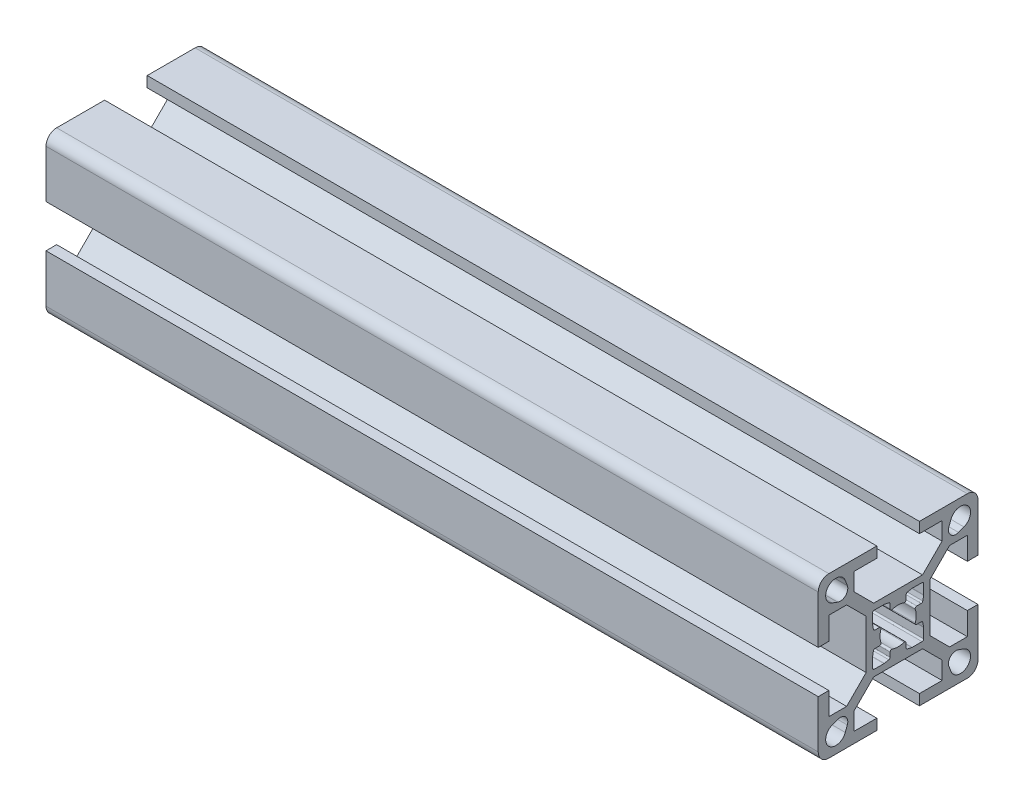
from build123d import *

# Parameters (mm, degrees)
BOSS_EXTRUDE1_DEPTH = 145


with BuildPart() as part:
    # Sketch1 → Boss-Extrude1 (new body)
    with BuildSketch(Plane(origin=(0, 0, 0), x_dir=(0, 0, -1), z_dir=(1, 0, 0))):
        with BuildLine():
            Line((-15, 13), (-15, 4))
            Line((-15, 4), (-13, 4))
            Line((-13, 4), (-13, 8.25))
            Line((-13, 8.25), (-9.664213562, 8.25))
            Line((-9.664213562, 8.25), (-6, 4.585786438))
            Line((-6, 4.585786438), (-6, -4.585786438))
            Line((-6, -4.585786438), (-9.664213562, -8.25))
            Line((-9.664213562, -8.25), (-13, -8.25))
            Line((-13, -8.25), (-13, -4))
            Line((-13, -4), (-15, -4))
            Line((-15, -4), (-15, -13))
            ThreePointArc((-15, -13), (-14.414213562, -14.414213562), (-13, -15))
            Line((-13, -15), (-4, -15))
            Line((-4, -15), (-4, -13))
            Line((-4, -13), (-8.25, -13))
            Line((-8.25, -13), (-8.25, -9.664213562))
            Line((-8.25, -9.664213562), (-4.585786438, -6))
            Line((-4.585786438, -6), (4.585786438, -6))
            Line((4.585786438, -6), (8.25, -9.664213562))
            Line((8.25, -9.664213562), (8.25, -13))
            Line((8.25, -13), (4, -13))
            Line((4, -13), (4, -15))
            Line((4, -15), (13, -15))
            ThreePointArc((13, -15), (14.414213562, -14.414213562), (15, -13))
            Line((15, -13), (15, -4))
            Line((15, -4), (13, -4))
            Line((13, -4), (13, -8.25))
            Line((13, -8.25), (9.664213562, -8.25))
            Line((9.664213562, -8.25), (6, -4.585786438))
            Line((6, -4.585786438), (6, 4.585786438))
            Line((6, 4.585786438), (9.664213562, 8.25))
            Line((9.664213562, 8.25), (13, 8.25))
            Line((13, 8.25), (13, 4))
            Line((13, 4), (15, 4))
            Line((15, 4), (15, 13))
            ThreePointArc((15, 13), (14.414213562, 14.414213562), (13, 15))
            Line((13, 15), (4, 15))
            Line((4, 15), (4, 13))
            Line((4, 13), (8.25, 13))
            Line((8.25, 13), (8.25, 9.664213562))
            Line((8.25, 9.664213562), (4.585786438, 6))
            Line((4.585786438, 6), (-4.585786438, 6))
            Line((-4.585786438, 6), (-8.25, 9.664213562))
            Line((-8.25, 9.664213562), (-8.25, 13))
            Line((-8.25, 13), (-4, 13))
            Line((-4, 13), (-4, 15))
            Line((-4, 15), (-13, 15))
            ThreePointArc((-13, 15), (-14.414213562, 14.414213562), (-15, 13))
        make_face()
        with BuildLine():
            Line((-9.539070071, 11.338915743), (-9.918883282, 12.361530981))
            ThreePointArc((-9.918883282, 12.361530981), (-13.043502884, 13.043502884), (-12.361530981, 9.918883282))
            Line((-12.361530981, 9.918883282), (-11.338915743, 9.539070071))
            ThreePointArc((-11.338915743, 9.539070071), (-9.861522369, 9.861522369), (-9.539070071, 11.338915743))
        make_face(mode=Mode.SUBTRACT)
        with BuildLine():
            Line((9.918883282, 12.361530981), (9.539070071, 11.338915743))
            ThreePointArc((9.539070071, 11.338915743), (9.861522369, 9.861522369), (11.338915743, 9.539070071))
            Line((11.338915743, 9.539070071), (12.361530981, 9.918883282))
            ThreePointArc((12.361530981, 9.918883282), (13.043502884, 13.043502884), (9.918883282, 12.361530981))
        make_face(mode=Mode.SUBTRACT)
        with BuildLine():
            Line((12.361530981, -9.918883282), (11.338915743, -9.539070071))
            ThreePointArc((11.338915743, -9.539070071), (9.861522369, -9.861522369), (9.539070071, -11.338915743))
            Line((9.539070071, -11.338915743), (9.918883282, -12.361530981))
            ThreePointArc((9.918883282, -12.361530981), (13.043502884, -13.043502884), (12.361530981, -9.918883282))
        make_face(mode=Mode.SUBTRACT)
        with BuildLine():
            Line((-11.338915743, -9.539070071), (-12.361530981, -9.918883282))
            ThreePointArc((-12.361530981, -9.918883282), (-13.043502884, -13.043502884), (-9.918883282, -12.361530981))
            Line((-9.918883282, -12.361530981), (-9.539070071, -11.338915743))
            ThreePointArc((-9.539070071, -11.338915743), (-9.861522369, -9.861522369), (-11.338915743, -9.539070071))
        make_face(mode=Mode.SUBTRACT)
        with BuildLine():
            Line((-4.8, -2.644433572), (-4.8, -4.5))
            ThreePointArc((-4.8, -4.5), (-4.712132034, -4.712132034), (-4.5, -4.8))
            Line((-4.5, -4.8), (-2.644433572, -4.8))
            ThreePointArc((-2.644433572, -4.8), (-2.615679847, -4.79861886), (-2.587190874, -4.794488155))
            Line((-2.587190874, -4.794488155), (-1.742757301, -4.630346896))
            ThreePointArc((-1.742757301, -4.630346896), (-1.568512625, -4.526682207), (-1.5, -4.335858741))
            Line((-1.5, -4.335858741), (-1.5, -3.5))
            ThreePointArc((-1.5, -3.5), (-1.374371458, -3.255879959), (-1.102702703, -3.216216216))
            ThreePointArc((-1.102702703, -3.216216216), (0, -3.4), (1.102702703, -3.216216216))
            ThreePointArc((1.102702703, -3.216216216), (1.374371458, -3.255879959), (1.5, -3.5))
            Line((1.5, -3.5), (1.5, -4.335858741))
            ThreePointArc((1.5, -4.335858741), (1.568512625, -4.526682207), (1.742757301, -4.630346896))
            Line((1.742757301, -4.630346896), (2.587190874, -4.794488155))
            ThreePointArc((2.587190874, -4.794488155), (2.615679847, -4.79861886), (2.644433572, -4.8))
            Line((2.644433572, -4.8), (4.5, -4.8))
            ThreePointArc((4.5, -4.8), (4.712132034, -4.712132034), (4.8, -4.5))
            Line((4.8, -4.5), (4.8, -2.644433572))
            ThreePointArc((4.8, -2.644433572), (4.79861886, -2.615679847), (4.794488155, -2.587190874))
            Line((4.794488155, -2.587190874), (4.630346896, -1.742757301))
            ThreePointArc((4.630346896, -1.742757301), (4.526682207, -1.568512625), (4.335858741, -1.5))
            Line((4.335858741, -1.5), (3.5, -1.5))
            ThreePointArc((3.5, -1.5), (3.255879959, -1.374371458), (3.216216216, -1.102702703))
            ThreePointArc((3.216216216, -1.102702703), (3.4, 0), (3.216216216, 1.102702703))
            ThreePointArc((3.216216216, 1.102702703), (3.255879959, 1.374371458), (3.5, 1.5))
            Line((3.5, 1.5), (4.335858741, 1.5))
            ThreePointArc((4.335858741, 1.5), (4.526682207, 1.568512625), (4.630346896, 1.742757301))
            Line((4.630346896, 1.742757301), (4.794488155, 2.587190874))
            ThreePointArc((4.794488155, 2.587190874), (4.79861886, 2.615679847), (4.8, 2.644433572))
            Line((4.8, 2.644433572), (4.8, 4.5))
            ThreePointArc((4.8, 4.5), (4.712132034, 4.712132034), (4.5, 4.8))
            Line((4.5, 4.8), (2.644433572, 4.8))
            ThreePointArc((2.644433572, 4.8), (2.615679847, 4.79861886), (2.587190874, 4.794488155))
            Line((2.587190874, 4.794488155), (1.742757301, 4.630346896))
            ThreePointArc((1.742757301, 4.630346896), (1.568512625, 4.526682207), (1.5, 4.335858741))
            Line((1.5, 4.335858741), (1.5, 3.5))
            ThreePointArc((1.5, 3.5), (1.374371458, 3.255879959), (1.102702703, 3.216216216))
            ThreePointArc((1.102702703, 3.216216216), (0, 3.4), (-1.102702703, 3.216216216))
            ThreePointArc((-1.102702703, 3.216216216), (-1.374371458, 3.255879959), (-1.5, 3.5))
            Line((-1.5, 3.5), (-1.5, 4.335858741))
            ThreePointArc((-1.5, 4.335858741), (-1.568512625, 4.526682207), (-1.742757301, 4.630346896))
            Line((-1.742757301, 4.630346896), (-2.587190874, 4.794488155))
            ThreePointArc((-2.587190874, 4.794488155), (-2.615679847, 4.79861886), (-2.644433572, 4.8))
            Line((-2.644433572, 4.8), (-4.5, 4.8))
            ThreePointArc((-4.5, 4.8), (-4.712132034, 4.712132034), (-4.8, 4.5))
            Line((-4.8, 4.5), (-4.8, 2.644433572))
            ThreePointArc((-4.8, 2.644433572), (-4.79861886, 2.615679847), (-4.794488155, 2.587190874))
            Line((-4.794488155, 2.587190874), (-4.630346896, 1.742757301))
            ThreePointArc((-4.630346896, 1.742757301), (-4.526682207, 1.568512625), (-4.335858741, 1.5))
            Line((-4.335858741, 1.5), (-3.5, 1.5))
            ThreePointArc((-3.5, 1.5), (-3.255879959, 1.374371458), (-3.216216216, 1.102702703))
            ThreePointArc((-3.216216216, 1.102702703), (-3.4, 0), (-3.216216216, -1.102702703))
            ThreePointArc((-3.216216216, -1.102702703), (-3.255879959, -1.374371458), (-3.5, -1.5))
            Line((-3.5, -1.5), (-4.335858741, -1.5))
            ThreePointArc((-4.335858741, -1.5), (-4.526682207, -1.568512625), (-4.630346896, -1.742757301))
            Line((-4.630346896, -1.742757301), (-4.794488155, -2.587190874))
            ThreePointArc((-4.794488155, -2.587190874), (-4.79861886, -2.615679847), (-4.8, -2.644433572))
        make_face(mode=Mode.SUBTRACT)
    extrude(amount=BOSS_EXTRUDE1_DEPTH)


solid = part.part
